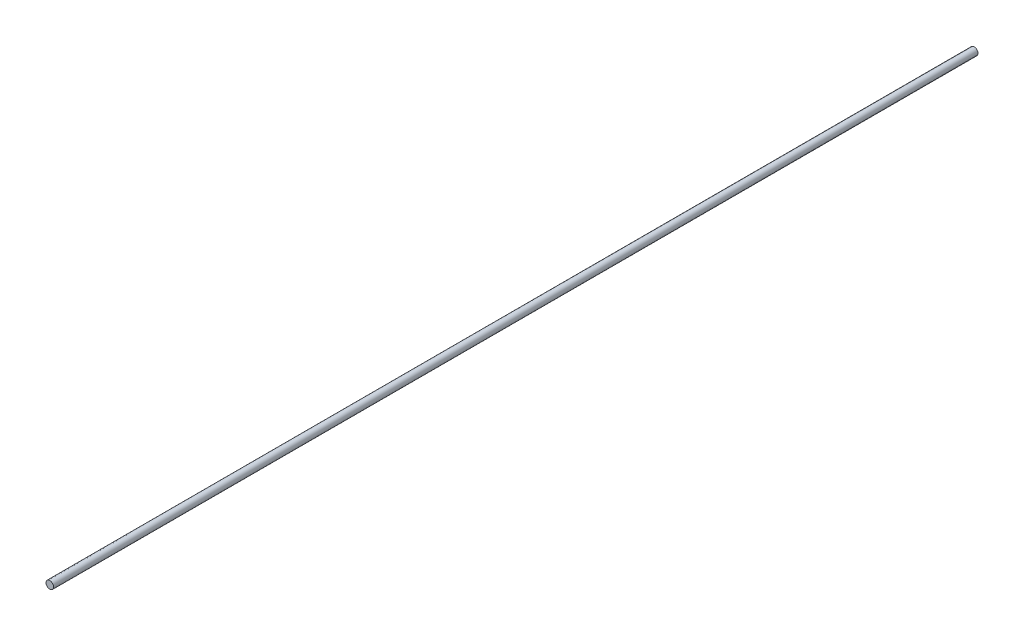
from build123d import *

# Parameters (mm, degrees)
SKETCH1_R           = 2.5
BOSS_EXTRUDE1_DEPTH = 609.6


with BuildPart() as part:
    # Sketch1 → Boss-Extrude1 (new body)
    with BuildSketch(Plane.XY):
        Circle(SKETCH1_R)
    extrude(amount=-BOSS_EXTRUDE1_DEPTH)


solid = part.part
